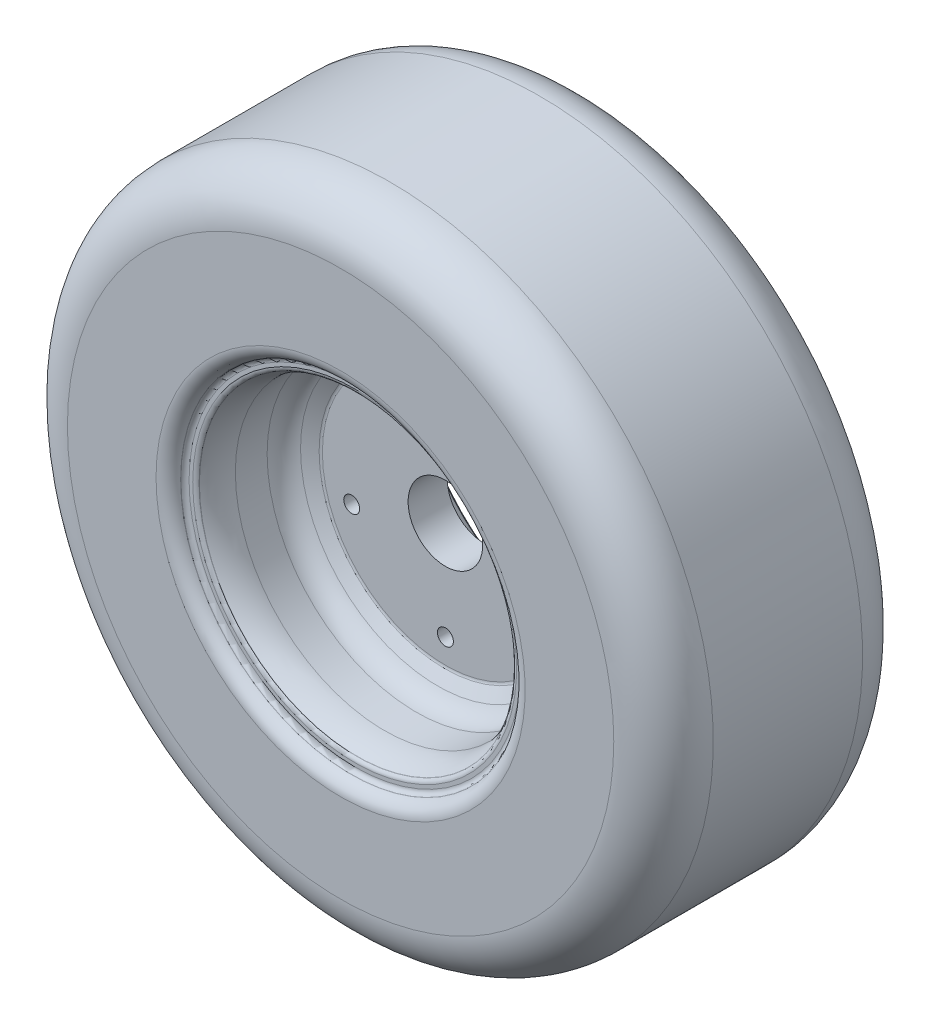
from build123d import *

# Parameters (mm, degrees)
CUT_EXTRUDE1_DEPTH      = 245.439476077
CUT_EXTRUDE1_DEPTH_BACK = 245.439476077
SKETCH3_R               = 4.064
SKETCH3_R_2             = 19.05


with BuildPart() as part:
    # Sketch1 → Revolve2 (revolve)
    with BuildSketch(Plane(origin=(0, 0, 0), x_dir=(0, 0, -1), z_dir=(1, 0, 0))):
        with BuildLine():
            Line((10, 0), (10, 62.796460729))
            ThreePointArc((10, 62.796460729), (10.092164082, 63.474472027), (10.361967969, 64.103279948))
            Line((10.361967969, 64.103279948), (13.920457656, 70.034096094))
            ThreePointArc((13.920457656, 70.034096094), (18.553342863, 74.551538816), (24.810617813, 76.2))
            Line((24.810617813, 76.2), (41.029492802, 76.2))
            ThreePointArc((41.029492802, 76.2), (48.390010178, 77.289862527), (55.118877786, 80.465922524))
            Line((55.118877786, 80.465922524), (55.208932498, 80.525958999))
            ThreePointArc((55.208932498, 80.525958999), (56.039447481, 81.440847616), (56.339994, 82.639366747))
            Line((56.339994, 82.639366747), (56.339994, 84.504637428))
            ThreePointArc((56.339994, 84.504637428), (56.828916206, 86.002863007), (58.107458476, 86.924304526))
            Line((58.107458476, 86.924304526), (58.197606571, 86.953086422))
            ThreePointArc((58.197606571, 86.953086422), (62.033233381, 89.717410979), (63.5, 94.212087715))
            Line((63.5, 94.212087715), (63.5, 139.446))
            ThreePointArc((63.5, 139.446), (56.060512242, 157.406512242), (38.1, 164.846))
            Line((38.1, 164.846), (24.13, 164.846))
            Line((24.13, 164.846), (0, 164.846))
            Line((0, 164.846), (-24.13, 164.846))
            Line((-24.13, 164.846), (-38.1, 164.846))
            ThreePointArc((-38.1, 164.846), (-56.060512242, 157.406512242), (-63.5, 139.446))
            Line((-63.5, 139.446), (-63.5, 94.212087715))
            ThreePointArc((-63.5, 94.212087715), (-62.033233381, 89.717410979), (-58.197606571, 86.953086422))
            Line((-58.197606571, 86.953086422), (-58.107458476, 86.924304526))
            ThreePointArc((-58.107458476, 86.924304526), (-56.828916206, 86.002863007), (-56.339994, 84.504637428))
            Line((-56.339994, 84.504637428), (-56.339994, 82.639366747))
            ThreePointArc((-56.339994, 82.639366747), (-56.039447481, 81.440847616), (-55.208932498, 80.525958999))
            Line((-55.208932498, 80.525958999), (-55.118877786, 80.465922524))
            ThreePointArc((-55.118877786, 80.465922524), (-48.390010178, 77.289862527), (-41.029492802, 76.2))
            Line((-41.029492802, 76.2), (-24.810617813, 76.2))
            ThreePointArc((-24.810617813, 76.2), (-18.553342863, 74.551538816), (-13.920457656, 70.034096094))
            Line((-13.920457656, 70.034096094), (-10.361967969, 64.103279948))
            ThreePointArc((-10.361967969, 64.103279948), (-10.092164082, 63.474472027), (-10, 62.796460729))
            Line((-10, 62.796460729), (-10, 0))
            Line((-10, 0), (10, 0))
        make_face()
        with BuildLine():
            Line((40.18, 161.0097726), (-40.18, 161.0097726))
            ThreePointArc((-40.18, 161.0097726), (-54.548409794, 155.058182393), (-60.5, 140.6897726))
            Line((-60.5, 140.6897726), (-60.5, 100.845958999))
            ThreePointArc((-60.5, 100.845958999), (-54.548409794, 86.477549205), (-40.18, 80.525958999))
            Line((-40.18, 80.525958999), (40.18, 80.525958999))
            ThreePointArc((40.18, 80.525958999), (54.548409794, 86.477549205), (60.5, 100.845958999))
            Line((60.5, 100.845958999), (60.5, 140.6897726))
            ThreePointArc((60.5, 140.6897726), (54.548409794, 155.058182393), (40.18, 161.0097726))
        make_face(mode=Mode.SUBTRACT)
    revolve(axis=Axis((0, 0, -76.2), (0, 0, 1)))

    # Sketch3 → Cut-Extrude1 (cut, two sides: drawn at the far end of the back side and taken through both)
    with BuildSketch(Plane(origin=(0, 0, -10), x_dir=(-1, 0, 0), z_dir=(0, 0, -1)).offset(-CUT_EXTRUDE1_DEPTH_BACK)):
        with Locations((0, -50.292)):
            Circle(SKETCH3_R)
        with Locations((-47.830534318, -15.541082681)):
            Circle(SKETCH3_R)
        with Locations((-29.560895908, 40.687082681)):
            Circle(SKETCH3_R)
        with Locations((29.560895908, 40.687082681)):
            Circle(SKETCH3_R)
        with Locations((47.830534318, -15.541082681)):
            Circle(SKETCH3_R)
        Circle(SKETCH3_R_2)
    extrude(amount=CUT_EXTRUDE1_DEPTH + CUT_EXTRUDE1_DEPTH_BACK, mode=Mode.SUBTRACT)


solid = part.part
